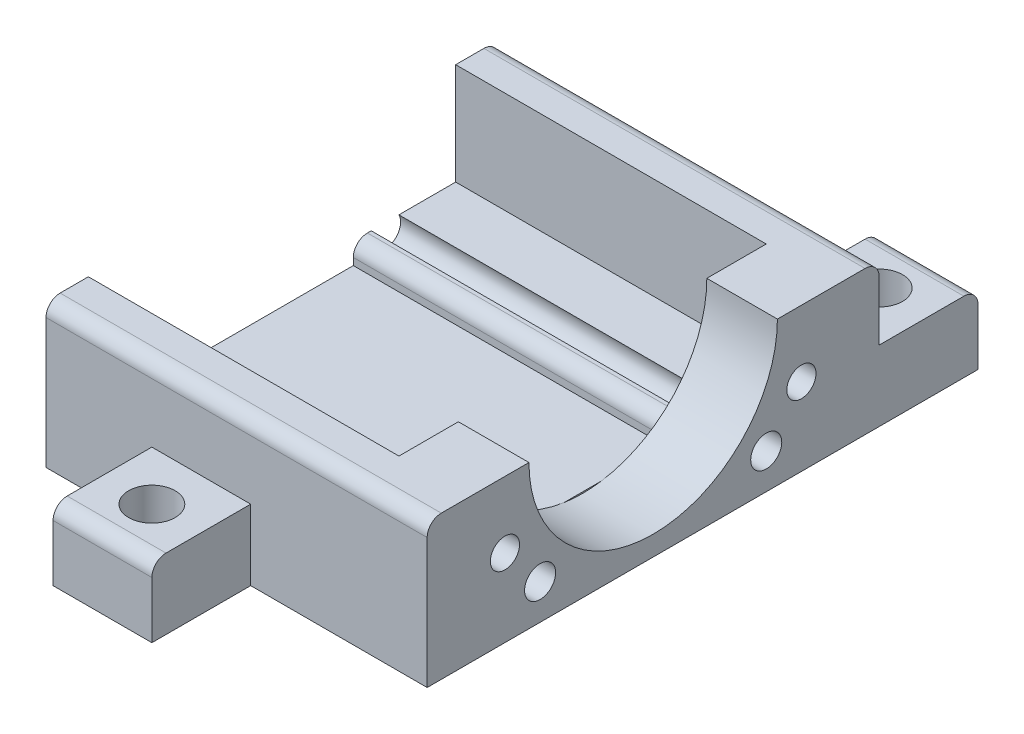
from build123d import *

# Parameters (mm, degrees)
BOSS_EXTRUDE1_DEPTH = 11
SKETCH3_W           = 22
SKETCH3_H           = 3
BOSS_EXTRUDE2_DEPTH = 10.2
BOSS_EXTRUDE3_DEPTH = 5
SKETCH5_R           = 1.035
SKETCH5_R_2         = 1.1
CUT_EXTRUDE1_DEPTH  = 34.004922045
SKETCH6_W           = 7
SKETCH6_H           = 7
BOSS_EXTRUDE4_DEPTH = 5
SKETCH7_R           = 1.65
CUT_EXTRUDE2_DEPTH  = 29.50349942
FILLET1_R           = 1


with BuildPart() as part:
    # Sketch1 → Boss-Extrude1 (new, symmetric)
    with BuildSketch(Plane(origin=(0, 0, 0), x_dir=(0, 0, -1), z_dir=(1, 0, 0))):
        Polygon((-13.0089, 0), (13.0089, 0), (13.0089, 3), (5.7589, 3), (5.7589, 1.5), (-5.7589, 1.5), (-5.7589, 3), (-13.0089, 3), align=None)
    extrude(amount=BOSS_EXTRUDE1_DEPTH, both=True)

    # Sketch3 → Boss-Extrude2 (add)
    with BuildSketch(Plane.XZ):
        with Locations((0, -14.5089)):
            Rectangle(SKETCH3_W, SKETCH3_H)
        with Locations((0, 14.5089)):
            Rectangle(SKETCH3_W, SKETCH3_H)
    extrude(amount=-BOSS_EXTRUDE2_DEPTH)

    # Sketch4 → Boss-Extrude3 (add)
    with BuildSketch(Plane(origin=(11, 0, 0), x_dir=(0, 0, -1), z_dir=(1, 0, 0))):
        with BuildLine():
            Line((-8.8, 10.2), (-16.0089, 10.2))
            Line((-16.0089, 10.2), (-16.0089, 0))
            Line((-16.0089, 0), (16.0089, 0))
            Line((16.0089, 0), (16.0089, 10.2))
            Line((16.0089, 10.2), (8.8, 10.2))
            ThreePointArc((8.8, 10.2), (0, 1.4), (-8.8, 10.2))
        make_face()
    extrude(amount=BOSS_EXTRUDE3_DEPTH)

    # Sketch5 → Cut-Extrude1 (cut, through all)
    with BuildSketch(Plane(origin=(16, 0, 0), x_dir=(0, 0, -1), z_dir=(1, 0, 0))):
        with Locations((-10.5, 5.5)):
            Circle(SKETCH5_R)
        with Locations((10.5, 5.5)):
            Circle(SKETCH5_R)
        with Locations((-8.0089, 2.5)):
            Circle(SKETCH5_R_2)
        with Locations(Location((8.0089, 2.5, 0), (0, 0, 27.035691789))):
            Circle(SKETCH5_R_2)
    extrude(amount=-CUT_EXTRUDE1_DEPTH, mode=Mode.SUBTRACT)

    # Sketch6 → Boss-Extrude4 (add)
    with BuildSketch(Plane.XZ):
        with Locations((0, 19.5089)):
            Rectangle(SKETCH6_W, SKETCH6_H)
        with Locations((12.5, -19.5089)):
            Rectangle(SKETCH6_W, SKETCH6_H)
    extrude(amount=-BOSS_EXTRUDE4_DEPTH)

    # Sketch7 → Cut-Extrude2 (cut, through all)
    with BuildSketch(Plane(origin=(0, 5, 0), x_dir=(1, 0, 0), z_dir=(0, 1, 0))):
        with Locations(Location((0, -19.5089, 0), (0, 0, 270))):
            Circle(SKETCH7_R)
        with Locations(Location((12.5, 19.5089, 0), (0, 0, 270))):
            Circle(SKETCH7_R)
    extrude(amount=-CUT_EXTRUDE2_DEPTH, mode=Mode.SUBTRACT)

    # Fillet1
    fillet1_edges = [part.edges().sort_by_distance(p)[0] for p in [
        (0, 5, 23.0089),
        (12.5, 5, -23.0089),
        (0, 3, 5.7589),
        (0, 3, -5.7589),
        (2.5, 10.2, -16.0089),
        (2.5, 10.2, 16.0089),
    ]]
    fillet(fillet1_edges, radius=FILLET1_R)


solid = part.part
